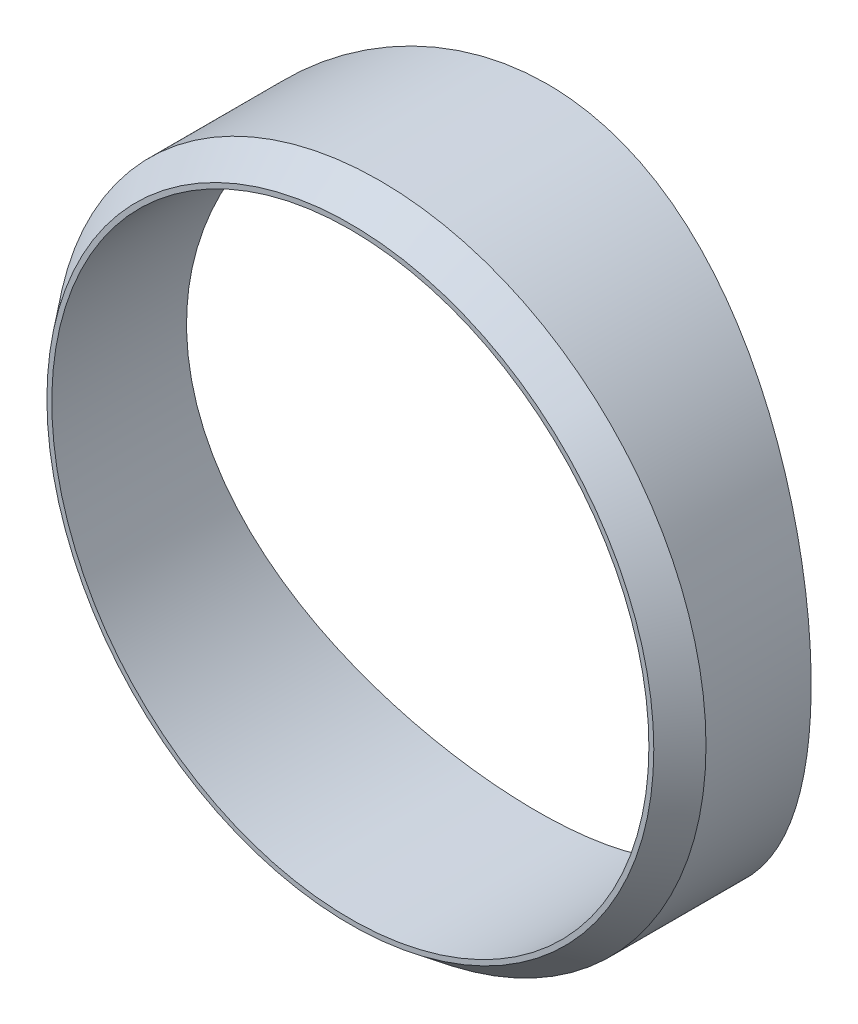
from build123d import *

# Parameters (mm, degrees)
SKETCH1_R               = 84.1375
SKETCH1_R_2             = 77.0255
EXTRUDE1_DEPTH          = 25.4
CHAMFER1_SIZE           = 7.62
CHAMFER1_SIZE2          = 5.847031648
CUT_EXTRUDE1_DEPTH      = 122.669214728
CUT_EXTRUDE2_DEPTH      = 122.669214887
CUT_EXTRUDE2_DEPTH_BACK = 122.669214887


with BuildPart() as part:
    # Sketch1 → Extrude1 (new, symmetric)
    with BuildSketch(Plane.XY):
        Circle(SKETCH1_R)
        Circle(SKETCH1_R_2, mode=Mode.SUBTRACT)
    extrude(amount=EXTRUDE1_DEPTH, both=True)

    # Chamfer1
    chamfer1_edges = [part.edges().sort_by_distance(p)[0] for p in [
        (-84.1375, 0, 25.4),
    ]]
    chamfer1_side = [part.faces().sort_by_distance(p)[0] for p in [
        (-84.1375, 0, 0),
    ]]
    chamfer(chamfer1_edges, length=CHAMFER1_SIZE, length2=CHAMFER1_SIZE2, reference=chamfer1_side[0])

    # Sketch2 → Cut-Extrude1 (cut, through all)
    with BuildSketch(Plane(origin=(0, 0, 0), x_dir=(0, 0, -1), z_dir=(1, 0, 0))):
        with BuildLine():
            Line((25.4, 84.1375), (25.4, -84.1375))
            ThreePointArc((25.4, -84.1375), (9.353148868, 0), (25.4, 84.1375))
        make_face()
    extrude(amount=-CUT_EXTRUDE1_DEPTH, mode=Mode.SUBTRACT)

    # Sketch2<2> → Cut-Extrude2 (cut, two sides: drawn at the far end of the back side and taken through both)
    with BuildSketch(Plane(origin=(0, 0, 0), x_dir=(0, 0, -1), z_dir=(1, 0, 0)).offset(-CUT_EXTRUDE2_DEPTH_BACK)):
        with BuildLine():
            Line((25.4, 84.1375), (25.4, -84.1375))
            ThreePointArc((25.4, -84.1375), (9.353148868, 0), (25.4, 84.1375))
        make_face()
    extrude(amount=CUT_EXTRUDE2_DEPTH + CUT_EXTRUDE2_DEPTH_BACK, mode=Mode.SUBTRACT)


solid = part.part
